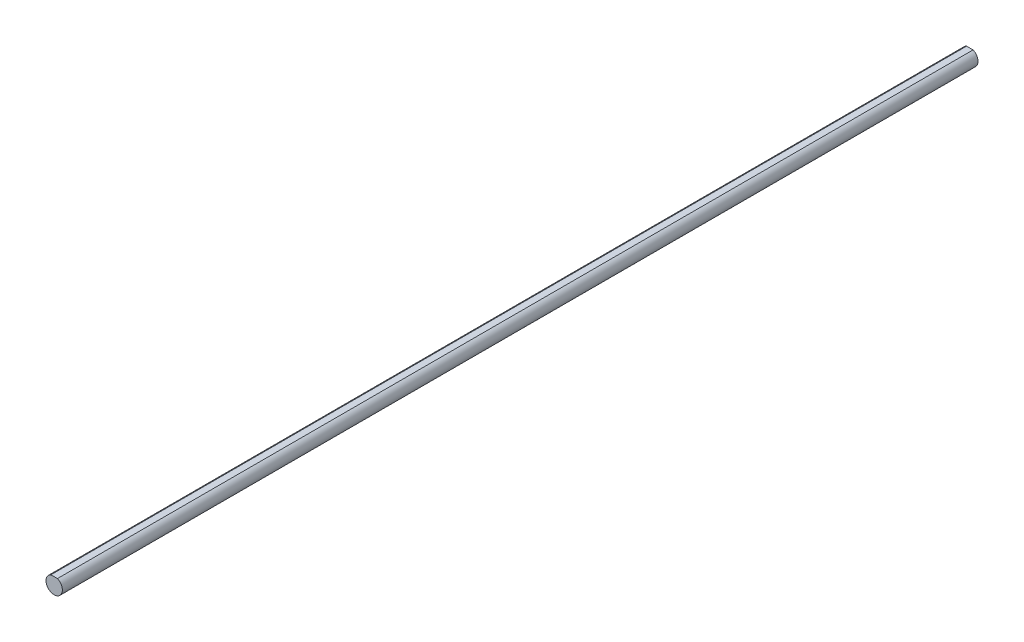
from build123d import *

# Parameters (mm, degrees)
BOSS_EXTRU_1_DEPTH = 280


with BuildPart() as part:
    # Esquisse1 → Boss.-Extru.1 (new body)
    with BuildSketch(Plane.XY):
        with BuildLine():
            Line((1, 2.291287847), (-1, 2.291287847))
            ThreePointArc((-1, 2.291287847), (-1.369306394, -2.091650066), (2.5, 0))
            ThreePointArc((2.5, 0), (2.091650066, 1.369306394), (1, 2.291287847))
        make_face()
    extrude(amount=BOSS_EXTRU_1_DEPTH)


solid = part.part
